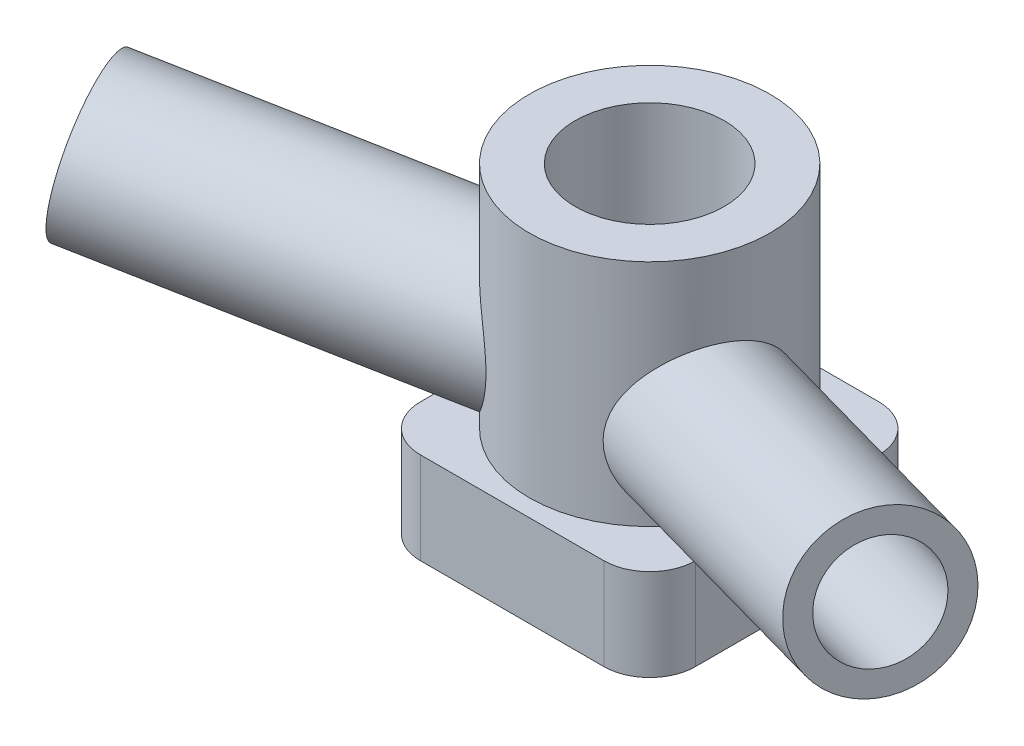
from build123d import *
from build123d.topology import SkipClean

# Parameters (mm, degrees)
ESQUISSE1_W        = 6
ESQUISSE1_H        = 12
BOSS_EXTRU_1_DEPTH = 4
EXTRU_MINCE1_DEPTH = 10
BOSS_EXTRU_3_START = -1.2
ESQUISSE4_R        = 3.25
ESQUISSE4_R_2      = 2.25
BOSS_EXTRU_3_DEPTH = 15
CONG_1_R           = 2


with BuildPart() as part:
    # Esquisse1 → Boss.-Extru.1 (new body)
    with BuildSketch(Plane(origin=(0, 0, 0), x_dir=(1, 0, 0), z_dir=(0, 1, 0))):
        with Locations((3, 0)):
            Rectangle(ESQUISSE1_W, ESQUISSE1_H)
    extrude(amount=BOSS_EXTRU_1_DEPTH)

    # Esquisse2 → Extru.-Mince1 (add)
    with BuildSketch(Plane(origin=(0, 4, 0), x_dir=(1, 0, 0), z_dir=(0, 1, 0))):
        with BuildLine():
            ThreePointArc((0, 3.25), (3.25, 0), (0, -3.25))
            Line((0, -3.25), (0, -5.25))
            ThreePointArc((0, -5.25), (5.25, 0), (0, 5.25))
            Line((0, 5.25), (0, 3.25))
        make_face()
    extrude(amount=EXTRU_MINCE1_DEPTH)

    # Esquisse4 → Boss.-Extru.3 (add)
    with BuildSketch(Plane(origin=(3.523744528, 0.673108836, 1.468226886), x_dir=(-0.3846153846153846, 0, 0.9230769230769231), z_dir=(-0.909053310472807, -0.173648177666934, -0.37877221269700284)).offset(BOSS_EXTRU_3_START)):
        with Locations((0, 6.272268589)):
            Circle(ESQUISSE4_R)
        with Locations((0, 6.272268589)):
            Circle(ESQUISSE4_R_2, mode=Mode.SUBTRACT)
    extrude(amount=-BOSS_EXTRU_3_DEPTH)

    # Symétrie1: part across plane


with BuildPart() as part_1:
    with SkipClean():  # the faces are left unmerged after this step: merging them gives an invalid solid
        add(part.part)
        add(part.part.mirror(Plane(origin=(0, 4, -6), x_dir=(0, 0, 1), z_dir=(1, 0, 0))))

    # Congé1
    cong_1_edges = [part_1.edges().sort_by_distance(p)[0] for p in [
        (-6, 2, 6),
        (-6, 2, -6),
        (6, 2, -6),
        (6, 2, 6),
    ]]
    fillet(cong_1_edges, radius=CONG_1_R)


solid = part_1.part
